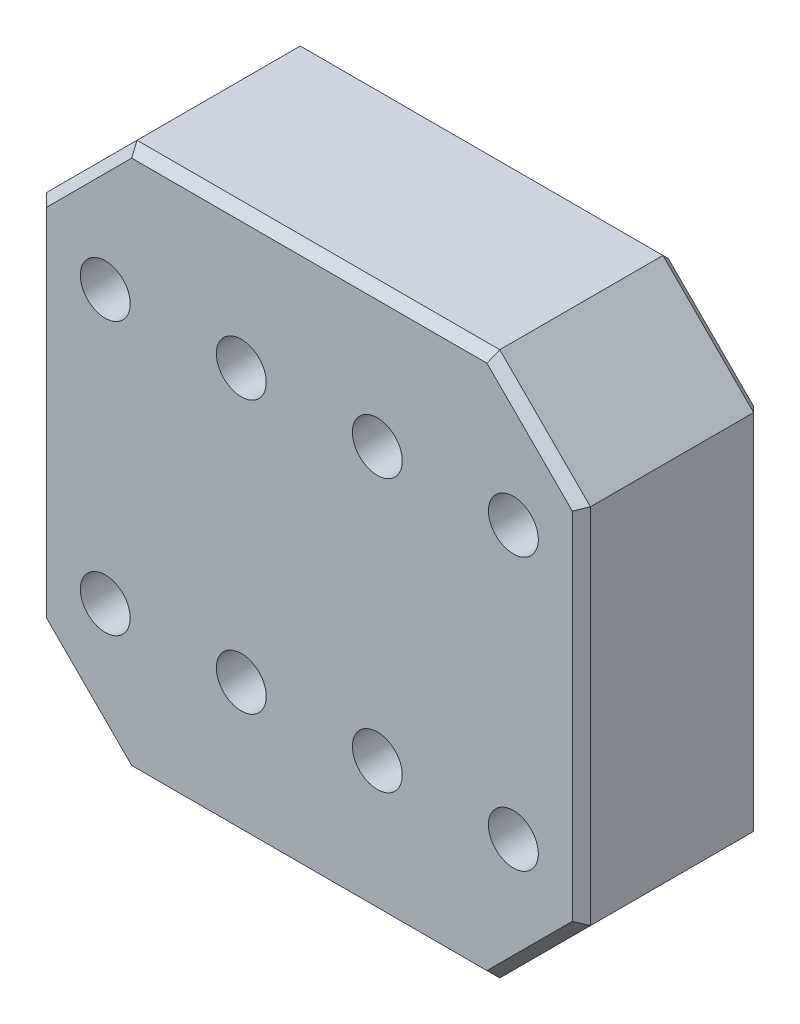
from build123d import *

# Parameters (mm, degrees)
SKETCH_1_W                = 60
SKETCH_1_H                = 60
EXTRUDE_1_DEPTH           = 20
HOLE_WIZARD_1_D           = 5.5
HOLE_WIZARD_1_CBORE_D     = 10
HOLE_WIZARD_1_CBORE_DEPTH = 14
CHAMFER_1_SIZE            = 10
CHAMFER_2_SIZE            = 1
HOLE_WIZARD_M10_1_D       = 8.5
HOLE_WIZARD_M10_1_DEPTH   = 16.5
HOLE_WIZARD_M10_1_TIP     = 2.553657631


with BuildPart() as part:
    # 草图1 → 凸台-拉伸1 (new body)
    with BuildSketch(Plane.XY):
        Rectangle(SKETCH_1_W, SKETCH_1_H)
    extrude(amount=EXTRUDE_1_DEPTH)

    # 打孔尺寸(%根据)内六角圆柱头螺钉的类型1 (through all)
    with Locations(Plane(origin=(0, 0, 0), x_dir=(-1, 0, 0), z_dir=(0, 0, -1))):
        with Locations((-22.5, 15), (-22.5, -15), (-7.5, 15), (-7.5, -15), (22.5, -15), (7.5, 15), (7.5, -15), (22.5, 15)):
            CounterBoreHole(HOLE_WIZARD_1_D / 2, HOLE_WIZARD_1_CBORE_D / 2, HOLE_WIZARD_1_CBORE_DEPTH)

    # 倒角1
    chamfer_1_edges = [part.edges().sort_by_distance(p)[0] for p in [
        (30, -30, 10),
        (-30, -30, 10),
        (-30, 30, 10),
        (30, 30, 10),
    ]]
    chamfer(chamfer_1_edges, length=CHAMFER_1_SIZE)

    # 倒角2
    chamfer_2_edges = [part.edges().sort_by_distance(p)[0] for p in [
        (0, -30, 0),
        (0, -30, 20),
        (30, 0, 0),
        (-30, 0, 0),
        (0, 30, 0),
        (25, 25, 0),
        (25, -25, 0),
        (-25, 25, 0),
        (-25, -25, 0),
        (-30, 0, 20),
        (30, 0, 20),
        (0, 30, 20),
        (25, 25, 20),
        (25, -25, 20),
        (-25, 25, 20),
        (-25, -25, 20),
    ]]
    chamfer(chamfer_2_edges, length=CHAMFER_2_SIZE)

    # M10 螺纹孔1
    with Locations(Plane(origin=(0, 0, 0), x_dir=(-1, 0, 0), z_dir=(0, 0, -1))):
        with Locations((0, 0)):
            Hole(HOLE_WIZARD_M10_1_D / 2, depth=HOLE_WIZARD_M10_1_DEPTH)
            with Locations((0, 0, -(HOLE_WIZARD_M10_1_DEPTH + HOLE_WIZARD_M10_1_TIP / 2))):  # 118° drill point
                Cone(0, HOLE_WIZARD_M10_1_D / 2, HOLE_WIZARD_M10_1_TIP, mode=Mode.SUBTRACT)


solid = part.part
